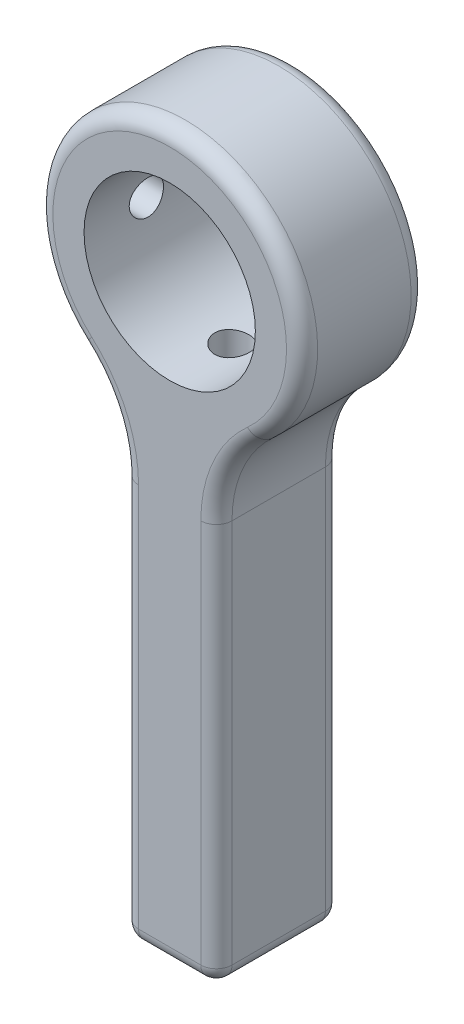
from build123d import *

# Parameters (mm, degrees)
SKETCH2_R           = 5.5
BOSS_EXTRUDE1_DEPTH = 8
SKETCH3_R           = 1.1
CUT_EXTRUDE1_DEPTH  = 40.752358421
CUT_EXTRUDE2_START  = -8
SKETCH5_R           = 1.75
CUT_EXTRUDE2_DEPTH  = 88
SKETCH6_R           = 1.1
CUT_EXTRUDE3_DEPTH  = 40.752358441
FILLET2_R           = 8
FILLET1_R           = 1


with BuildPart() as part:
    # Sketch2 → Boss-Extrude1 (new body)
    with BuildSketch(Plane.XY):
        with BuildLine():
            Line((0, -38), (3, -38))
            Line((3, -38), (3, -7.95298686))
            ThreePointArc((3, -7.95298686), (0, 8.5), (-3, -7.95298686))
            Line((-3, -7.95298686), (-3, -38))
            Line((-3, -38), (0, -38))
        make_face()
        Circle(SKETCH2_R, mode=Mode.SUBTRACT)
    extrude(amount=BOSS_EXTRUDE1_DEPTH)

    # Sketch3 → Cut-Extrude1 (cut, through all)
    with BuildSketch(Plane(origin=(0, 0, 0), x_dir=(1, 0, 0), z_dir=(0, 1, 0))):
        with Locations(Location((0, -4, 0), (0, 0, 270))):
            Circle(SKETCH3_R)
    extrude(amount=-CUT_EXTRUDE1_DEPTH, mode=Mode.SUBTRACT)

    # Sketch5 → Cut-Extrude2 (cut)
    with BuildSketch(Plane(origin=(0, 0, 0), x_dir=(1, 0, 0), z_dir=(0, 1, 0)).offset(CUT_EXTRUDE2_START)):
        with Locations(Location((0, -4, 0), (0, 0, 270))):
            Circle(SKETCH5_R)
    extrude(amount=-CUT_EXTRUDE2_DEPTH, mode=Mode.SUBTRACT)

    # Sketch6 → Cut-Extrude3 (cut, through all)
    with BuildSketch(Plane(origin=(0, 0, 0), x_dir=(0, 0, -1), z_dir=(1, 0, 0))):
        with Locations((-4, 0)):
            Circle(SKETCH6_R)
    extrude(amount=-CUT_EXTRUDE3_DEPTH, mode=Mode.SUBTRACT)

    # Fillet2
    fillet2_edges = [part.edges().sort_by_distance(p)[0] for p in [
        (3, -7.95298686, 4),
        (-3, -7.95298686, 4),
    ]]
    fillet(fillet2_edges, radius=FILLET2_R)

    # Fillet1
    fillet1_edges = [part.edges().sort_by_distance(p)[0] for p in [
        (0, -38, 8),
        (3, -25.149186938, 8),
        (0, 8.5, 0),
        (0, 8.5, 8),
        (-3, -25.149186938, 0),
        (-3, -25.149186938, 8),
        (3.697032567, -9.032387553, 0),
        (3.697032567, -9.032387553, 8),
        (-3.697032567, -9.032387553, 0),
        (-3.697032567, -9.032387553, 8),
        (3, -25.149186938, 0),
        (0, -38, 0),
        (3, -38, 4),
        (-3, -38, 4),
    ]]
    fillet(fillet1_edges, radius=FILLET1_R)


solid = part.part
